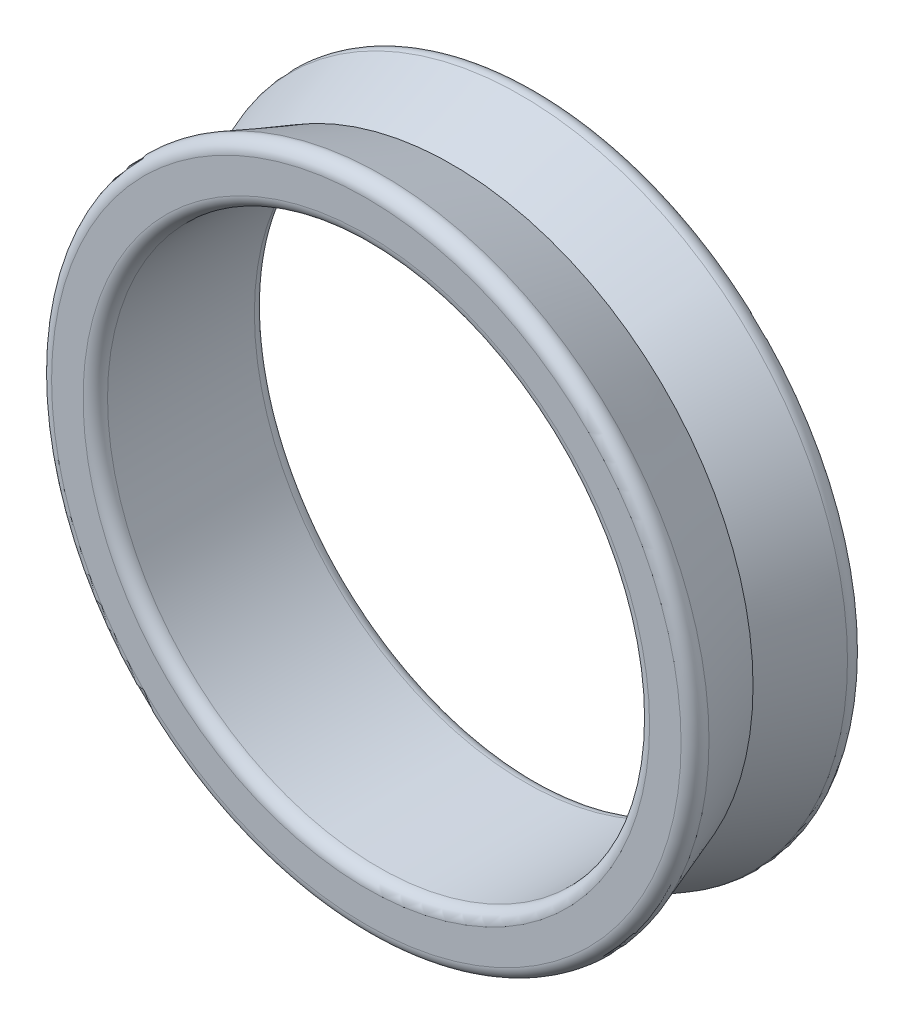
from build123d import *

# Parameters (mm, degrees)
SKETCH1_R           = 13.575
SKETCH1_R_2         = 11.075
BOSS_EXTRUDE1_DEPTH = 7
FILLET1_R           = 0.5
FILLET2_R           = 0.5


with BuildPart() as part:
    # Sketch1 → Boss-Extrude1 (new body)
    with BuildSketch(Plane.XY):
        Circle(SKETCH1_R)
        Circle(SKETCH1_R_2, mode=Mode.SUBTRACT)
    extrude(amount=BOSS_EXTRUDE1_DEPTH)

    # Sketch2 → Cut-Revolve1 (revolve, cut)
    with BuildSketch(Plane(origin=(0, 0, 0), x_dir=(1, 0, 0), z_dir=(0, 1, 0)), mode=Mode.PRIVATE) as cut_revolve1_sk:
        Polygon((13.575, 0), (12.30110418, -3.5), (13.575, -7), align=None)
    revolve(cut_revolve1_sk.sketch.rotate(Axis((0, 0, 0), (0, 0, 1)), 180), axis=Axis((0, 0, 0), (0, 0, 1)), mode=Mode.SUBTRACT)

    # Fillet1
    fillet1_edges = [part.edges().sort_by_distance(p)[0] for p in [
        (13.575, 0, 7),
        (13.575, 0, 0),
    ]]
    fillet(fillet1_edges, radius=FILLET1_R)

    # Fillet2
    fillet2_edges = [part.edges().sort_by_distance(p)[0] for p in [
        (-11.075, 0, 0),
        (-11.075, 0, 7),
    ]]
    fillet(fillet2_edges, radius=FILLET2_R)


solid = part.part
